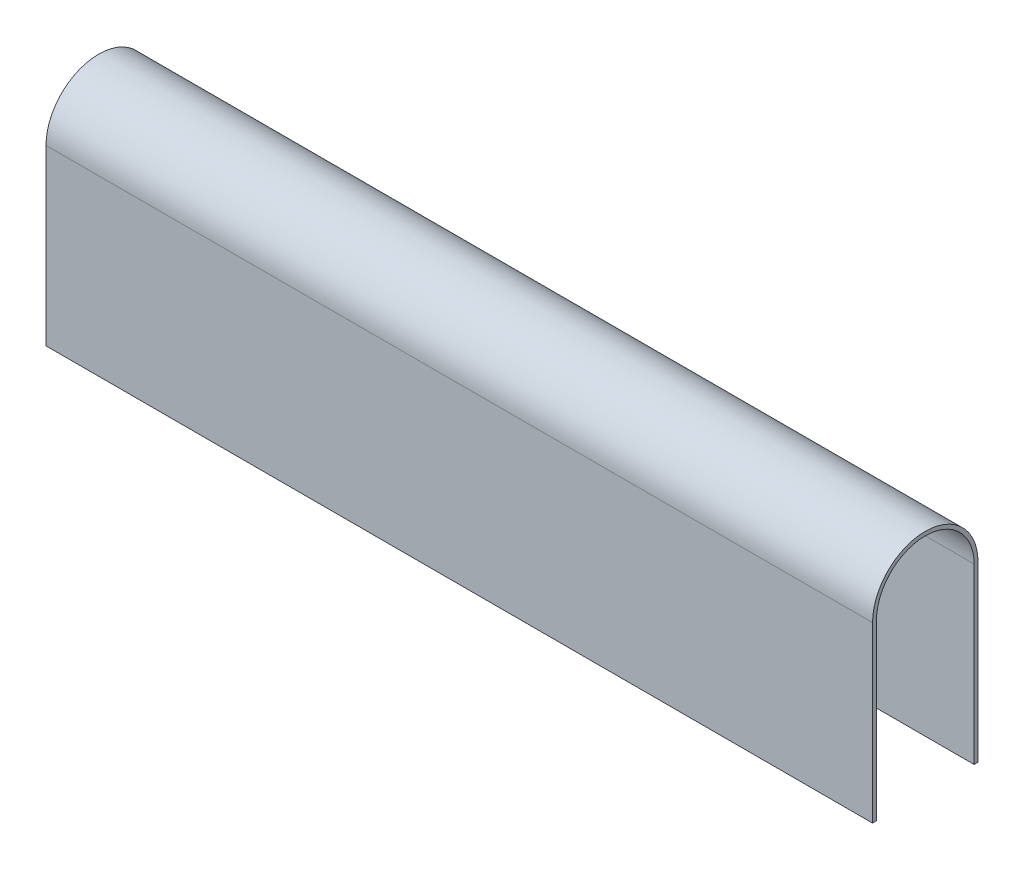
from build123d import *

# Parameters (mm, degrees)
BOSS_EXTRUDE1_DEPTH = 322.5133


with BuildPart() as part:
    # Sketch1 → Boss-Extrude1 (new body)
    with BuildSketch(Plane(origin=(0, 0, 0), x_dir=(0, 0, -1), z_dir=(1, 0, 0))):
        with BuildLine():
            Line((-30.099, 67.7418), (-30.099, 0))
            Line((-30.099, 0), (-28.575, 0))
            Line((-28.575, 0), (-28.575, 67.7418))
            ThreePointArc((-28.575, 67.7418), (-9.525, 86.7918), (9.525, 67.7418))
            Line((9.525, 67.7418), (9.525, 0))
            Line((9.525, 0), (11.049, 0))
            Line((11.049, 0), (11.049, 67.7418))
            ThreePointArc((11.049, 67.7418), (-9.525, 88.3158), (-30.099, 67.7418))
        make_face()
    extrude(amount=BOSS_EXTRUDE1_DEPTH)


solid = part.part
